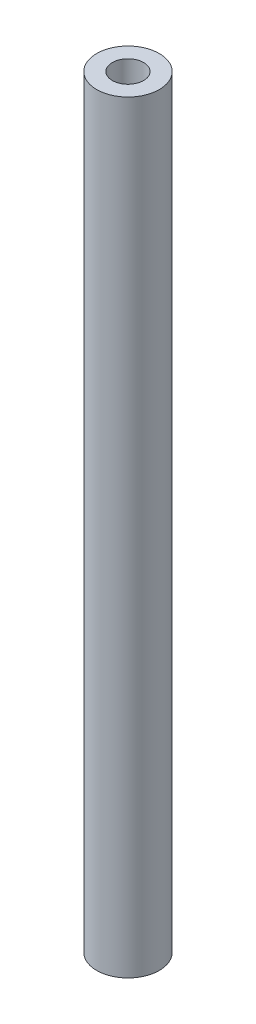
from build123d import *

# Parameters (mm, degrees)
SKETCH1_R           = 2
SKETCH1_R_2         = 1
BOSS_EXTRUDE1_DEPTH = 24.4


with BuildPart() as part:
    # Sketch1 → Boss-Extrude1 (new, symmetric)
    with BuildSketch(Plane(origin=(0, 0, 0), x_dir=(1, 0, 0), z_dir=(0, 1, 0))):
        with Locations(Location((0, 0, 0), (0, 0, 270))):
            Circle(SKETCH1_R)
        with Locations(Location((0, 0, 0), (0, 0, 270))):
            Circle(SKETCH1_R_2, mode=Mode.SUBTRACT)
    extrude(amount=BOSS_EXTRUDE1_DEPTH, both=True)


solid = part.part
